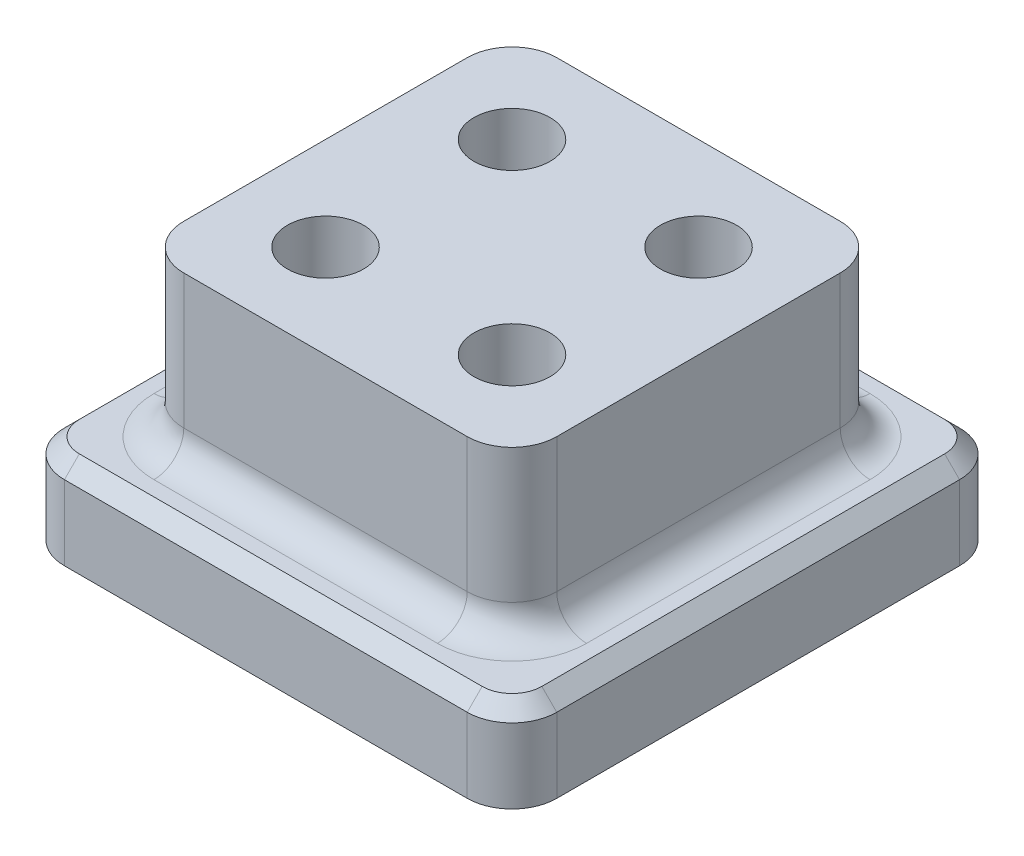
from build123d import *

# Parameters (mm, degrees)
SKETCH_1_R          = 2.175
EXTRUDE_4_DEPTH     = 6
SKETCH_1_3_R        = 2.175
CUT_EXTRUDE_3_DEPTH = 4.5
SKETCH_8_R          = 2.55
EXTRUDE_5_DEPTH     = 11
FILLET_1_R          = 2
CUT_EXTRUDE_START   = -5
SKETCH_8_2_R        = 2.55
CUT_EXTRUDE_4_DEPTH = 5
CHAMFER_1_SIZE      = 1


with BuildPart() as part:
    # 草图1 → 凸台-拉伸4 (new body)
    # profile 1 of 6: a face of its own
    with BuildSketch(Plane(origin=(0, 0, 0), x_dir=(1, 0, 0), z_dir=(0, 1, 0))):
        with BuildLine():
            Line((-13.5, 16.5), (13.5, 16.5))
            ThreePointArc((13.5, 16.5), (15.621320344, 15.621320344), (16.5, 13.5))
            Line((16.5, 13.5), (16.5, -13.5))
            ThreePointArc((16.5, -13.5), (15.621320344, -15.621320344), (13.5, -16.5))
            Line((13.5, -16.5), (-13.5, -16.5))
            ThreePointArc((-13.5, -16.5), (-15.621320344, -15.621320344), (-16.5, -13.5))
            Line((-16.5, -13.5), (-16.5, 13.5))
            ThreePointArc((-16.5, 13.5), (-15.621320344, 15.621320344), (-13.5, 16.5))
        make_face()
        with Locations((-10.5, 10.5)):
            Circle(SKETCH_1_R, mode=Mode.SUBTRACT)
        with Locations((10.5, 10.5)):
            Circle(SKETCH_1_R, mode=Mode.SUBTRACT)
        with Locations((10.5, -10.5)):
            Circle(SKETCH_1_R, mode=Mode.SUBTRACT)
        with Locations((-10.5, -10.5)):
            Circle(SKETCH_1_R, mode=Mode.SUBTRACT)
        Circle(SKETCH_1_R, mode=Mode.SUBTRACT)
    # profile 2 of 6: a face of its own
    with BuildSketch(Plane(origin=(0, 0, 0), x_dir=(1, 0, 0), z_dir=(0, 1, 0))):
        with Locations((10.5, -10.5)):
            Circle(SKETCH_1_R)
    # profile 3 of 6: a face of its own
    with BuildSketch(Plane(origin=(0, 0, 0), x_dir=(1, 0, 0), z_dir=(0, 1, 0))):
        with Locations((10.5, 10.5)):
            Circle(SKETCH_1_R)
    # profile 4 of 6: a face of its own
    with BuildSketch(Plane(origin=(0, 0, 0), x_dir=(1, 0, 0), z_dir=(0, 1, 0))):
        with Locations((-10.5, 10.5)):
            Circle(SKETCH_1_R)
    # profile 5 of 6: a face of its own
    with BuildSketch(Plane(origin=(0, 0, 0), x_dir=(1, 0, 0), z_dir=(0, 1, 0))):
        Circle(SKETCH_1_R)
    # profile 6 of 6: a face of its own
    with BuildSketch(Plane(origin=(0, 0, 0), x_dir=(1, 0, 0), z_dir=(0, 1, 0))):
        with Locations((-10.5, -10.5)):
            Circle(SKETCH_1_R)
    extrude(amount=EXTRUDE_4_DEPTH)

    # 草图1<3> → 切除-拉伸3 (cut)
    with BuildSketch(Plane(origin=(0, 0, 0), x_dir=(1, 0, 0), z_dir=(0, 1, 0))):
        with Locations(Location((10.5, -10.5, 0), (0, 0, 270))):
            Circle(SKETCH_1_3_R)
        with Locations(Location((10.5, 10.5, 0), (0, 0, 270))):
            Circle(SKETCH_1_3_R)
        with Locations(Location((-10.5, 10.5, 0), (0, 0, 270))):
            Circle(SKETCH_1_3_R)
        with Locations(Location((-10.5, -10.5, 0), (0, 0, 270))):
            Circle(SKETCH_1_3_R)
        with Locations(Location((0, 0, 0), (0, 0, 270))):
            Circle(SKETCH_1_3_R)
    extrude(amount=CUT_EXTRUDE_3_DEPTH, mode=Mode.SUBTRACT)

    # 草图8 → 凸台-拉伸5 (add)
    with BuildSketch(Plane(origin=(0, 6, 0), x_dir=(1, 0, 0), z_dir=(0, 1, 0))):
        with BuildLine():
            Line((-9.5, 12.5), (9.5, 12.5))
            ThreePointArc((9.5, 12.5), (11.621320344, 11.621320344), (12.5, 9.5))
            Line((12.5, 9.5), (12.5, -9.5))
            ThreePointArc((12.5, -9.5), (11.621320344, -11.621320344), (9.5, -12.5))
            Line((9.5, -12.5), (-9.5, -12.5))
            ThreePointArc((-9.5, -12.5), (-11.621320344, -11.621320344), (-12.5, -9.5))
            Line((-12.5, -9.5), (-12.5, 9.5))
            ThreePointArc((-12.5, 9.5), (-11.621320344, 11.621320344), (-9.5, 12.5))
        make_face()
        with Locations(Location((-6.25, 6.25, 0), (0, 0, 270))):
            Circle(SKETCH_8_R, mode=Mode.SUBTRACT)
        with Locations(Location((6.25, 6.25, 0), (0, 0, 270))):
            Circle(SKETCH_8_R, mode=Mode.SUBTRACT)
        with Locations(Location((-6.25, -6.25, 0), (0, 0, 270))):
            Circle(SKETCH_8_R, mode=Mode.SUBTRACT)
        with Locations(Location((6.25, -6.25, 0), (0, 0, 270))):
            Circle(SKETCH_8_R, mode=Mode.SUBTRACT)
    extrude(amount=EXTRUDE_5_DEPTH)

    # 圆角1
    fillet_1_edges = [part.edges().sort_by_distance(p)[0] for p in [
        (11.621320344, 6, 11.621320344),
        (12.5, 6, 0),
        (11.621320344, 6, -11.621320344),
        (0, 6, -12.5),
        (-11.621320344, 6, -11.621320344),
        (-12.5, 6, 0),
        (-11.621320344, 6, 11.621320344),
        (0, 6, 12.5),
    ]]
    fillet(fillet_1_edges, radius=FILLET_1_R)

    # 草图8<2> → 切除-拉伸4 (cut)
    with BuildSketch(Plane(origin=(0, 6, 0), x_dir=(1, 0, 0), z_dir=(0, 1, 0)).offset(CUT_EXTRUDE_START)):
        with Locations(Location((-6.25, 6.25, 0), (0, 0, 270))):
            Circle(SKETCH_8_2_R)
        with Locations(Location((6.25, 6.25, 0), (0, 0, 270))):
            Circle(SKETCH_8_2_R)
        with Locations(Location((6.25, -6.25, 0), (0, 0, 270))):
            Circle(SKETCH_8_2_R)
        with Locations(Location((-6.25, -6.25, 0), (0, 0, 270))):
            Circle(SKETCH_8_2_R)
    extrude(amount=CUT_EXTRUDE_4_DEPTH, mode=Mode.SUBTRACT)

    # 倒角1
    chamfer_1_edges = [part.edges().sort_by_distance(p)[0] for p in [
        (-16.5, 6, 0),
        (-15.621320344, 6, 15.621320344),
        (0, 6, 16.5),
        (15.621320344, 6, 15.621320344),
        (16.5, 6, 0),
        (15.621320344, 6, -15.621320344),
        (0, 6, -16.5),
        (-15.621320344, 6, -15.621320344),
    ]]
    chamfer(chamfer_1_edges, length=CHAMFER_1_SIZE)


solid = part.part
